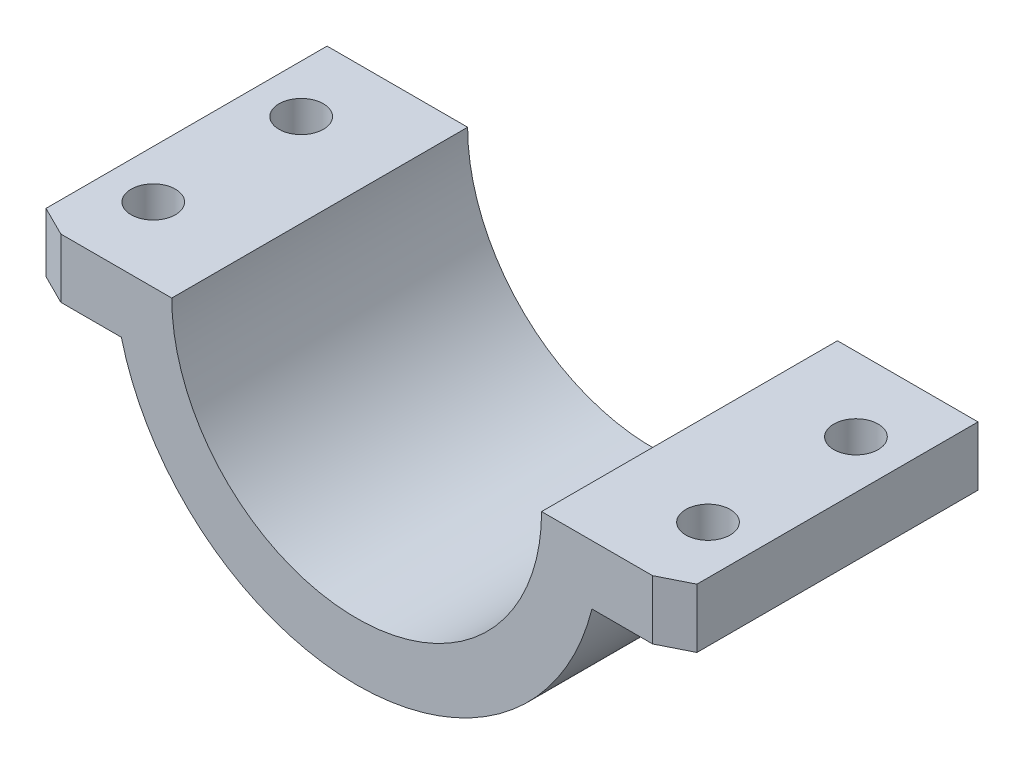
from build123d import *

# Parameters (mm, degrees)
RESSALTO_EXTRUS_O1_DEPTH = 20
ESBO_O2_R                = 1.5
CORTE_EXTRUS_O1_DEPTH    = 61.731016524
CORTE_EXTRUS_O2_DEPTH    = 61.731016524


with BuildPart() as part:
    # Esboço1 → Ressalto-extrusão1 (new body)
    with BuildSketch(Plane.XY):
        with BuildLine():
            Line((-54.948124335, 11.894856768), (-45.448124335, 11.894856768))
            ThreePointArc((-45.448124335, 11.894856768), (-32.948124335, -0.605143232), (-20.448124335, 11.894856768))
            Line((-20.448124335, 11.894856768), (-10.948124335, 11.894856768))
            Line((-10.948124335, 11.894856768), (-10.948124335, 7.894856768))
            Line((-10.948124335, 7.894856768), (-17.043408054, 7.894856768))
            ThreePointArc((-17.043408054, 7.894856768), (-32.948124335, -4.505143232), (-48.852840617, 7.894856768))
            Line((-48.852840617, 7.894856768), (-54.948124335, 7.894856768))
            Line((-54.948124335, 7.894856768), (-54.948124335, 11.894856768))
        make_face()
    extrude(amount=RESSALTO_EXTRUS_O1_DEPTH)

    # Esboço2 → Corte-extrusão1 (cut, through all)
    with BuildSketch(Plane(origin=(0, 11.894856768, 0), x_dir=(1, 0, 0), z_dir=(0, 1, 0))):
        with Locations(Location((-51.698124335, -5, 0), (0, 0, 270))):
            Circle(ESBO_O2_R)
        with Locations(Location((-51.698124335, -15, 0), (0, 0, 270))):
            Circle(ESBO_O2_R)
        with Locations(Location((-14.198124335, -5, 0), (0, 0, 270))):
            Circle(ESBO_O2_R)
        with Locations(Location((-14.198124335, -15, 0), (0, 0, 270))):
            Circle(ESBO_O2_R)
    extrude(amount=-CORTE_EXTRUS_O1_DEPTH, mode=Mode.SUBTRACT)

    # Esboço3 → Corte-extrusão2 (cut, through all)
    with BuildSketch(Plane(origin=(0, 11.894856768, 0), x_dir=(1, 0, 0), z_dir=(0, 1, 0))):
        Polygon((-10.948124335, -21.140031795), (-8.775432295, -20.480907324), (-9.177542531, -19.85151739), (-10.948124335, -19), (-12.948124335, -20), (-13.238837314, -21.140031795), align=None)
        Polygon((-54.948124335, -19), (-52.948124335, -20), (-52.948124335, -22.628376124), (-56.762312397, -22.628376124), (-56.762312397, -19), align=None)
    extrude(amount=-CORTE_EXTRUS_O2_DEPTH, mode=Mode.SUBTRACT)


solid = part.part
